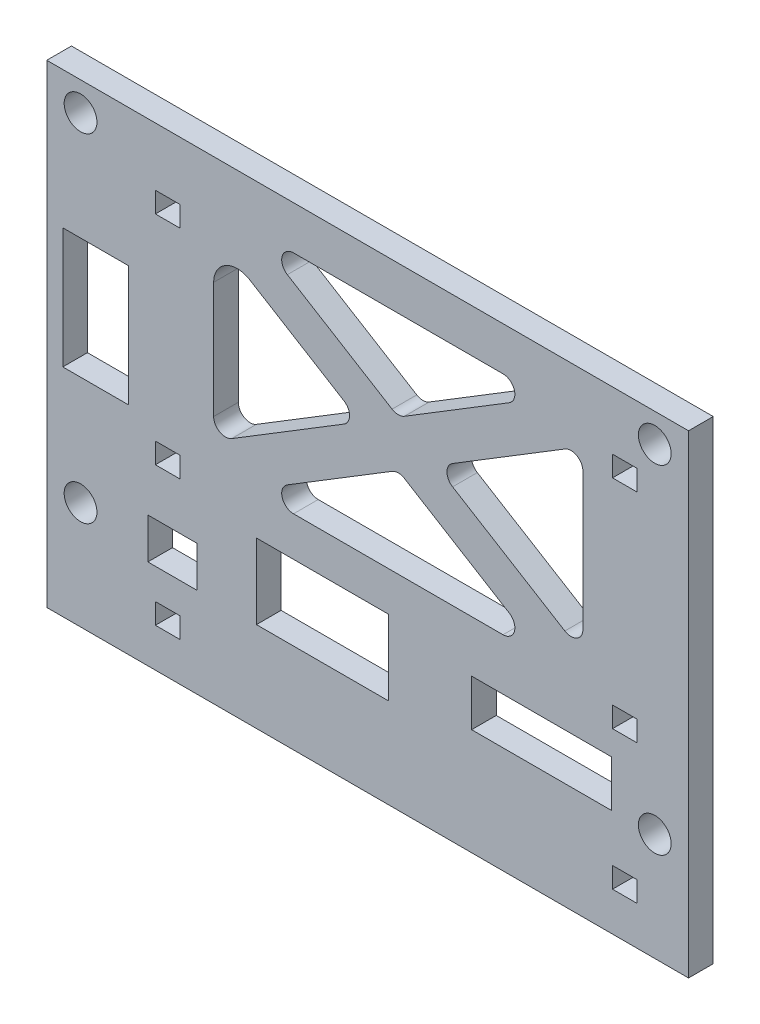
from build123d import *

# Parameters (mm, degrees)
SKETCH1_W              = 41.275
SKETCH1_H              = 25.4
SKETCH1_R              = 1.0541
SKETCH1_H_2            = 5.08
BOSS_EXTRUDE1_DEPTH    = 1.5875
ATTACHMENT_HOLES_REACH = 34.766
SKETCH3_W              = 1.5875
SKETCH3_H              = 1.3208
SKETCH2_W              = 8.509
SKETCH2_H              = 4.826
SKETCH2_W_2            = 4.22
SKETCH2_H_2            = 7.75
SKETCH2_W_3            = 3.175
SKETCH2_H_3            = 2.6162
SKETCH2_W_4            = 9
SKETCH2_H_4            = 2.985879982
CUT_EXTRUDE1_DEPTH     = 1.5875
FILLET8_R              = 0.762
FILLET9_R              = 1.524


with BuildPart() as part:
    # Sketch1 → Boss-Extrude1 (new body)
    # profile 1 of 2: a face of its own
    with BuildSketch(Plane.XY):
        with Locations((0, 12.7)):
            Rectangle(SKETCH1_W, SKETCH1_H)
        with Locations((-18.4658, 1.8415)):
            Circle(SKETCH1_R, mode=Mode.SUBTRACT)
        with Locations((18.4658, 1.8415)):
            Circle(SKETCH1_R, mode=Mode.SUBTRACT)
        with Locations((-18.4658, 23.5585)):
            Circle(SKETCH1_R, mode=Mode.SUBTRACT)
        with Locations((18.4658, 23.5585)):
            Circle(SKETCH1_R, mode=Mode.SUBTRACT)
    # profile 2 of 2: a face of its own
    with BuildSketch(Plane.XY):
        with Locations((0, -2.54)):
            Rectangle(SKETCH1_W, SKETCH1_H_2)
    extrude(amount=BOSS_EXTRUDE1_DEPTH)

    # Sketch3 → Attachment Holes (cut, up to next)
    with BuildSketch(Plane(origin=(0, 0, 0), x_dir=(-1, 0, 0), z_dir=(0, 0, -1)), mode=Mode.PRIVATE) as attachment_holes_sk1:
        with Locations((-16.54175, 20.992155968)):
            Rectangle(SKETCH3_W, SKETCH3_H)
    attachment_holes_tool1 = extrude(attachment_holes_sk1.sketch, amount=-ATTACHMENT_HOLES_REACH, mode=Mode.PRIVATE) & part.part
    # Sketch3 → Attachment Holes (cut, up to next)
    with BuildSketch(Plane(origin=(0, 0, 0), x_dir=(-1, 0, 0), z_dir=(0, 0, -1)), mode=Mode.PRIVATE) as attachment_holes_sk2:
        with Locations((-16.54175, 7.022155968)):
            Rectangle(SKETCH3_W, SKETCH3_H)
    attachment_holes_tool2 = extrude(attachment_holes_sk2.sketch, amount=-ATTACHMENT_HOLES_REACH, mode=Mode.PRIVATE) & part.part
    # Sketch3 → Attachment Holes (cut, up to next)
    with BuildSketch(Plane(origin=(0, 0, 0), x_dir=(-1, 0, 0), z_dir=(0, 0, -1)), mode=Mode.PRIVATE) as attachment_holes_sk3:
        with Locations((-16.54175, -1.918644032)):
            Rectangle(SKETCH3_W, SKETCH3_H)
    attachment_holes_tool3 = extrude(attachment_holes_sk3.sketch, amount=-ATTACHMENT_HOLES_REACH, mode=Mode.PRIVATE) & part.part
    # Sketch3 → Attachment Holes (cut, up to next)
    with BuildSketch(Plane(origin=(0, 0, 0), x_dir=(-1, 0, 0), z_dir=(0, 0, -1)), mode=Mode.PRIVATE) as attachment_holes_sk4:
        with Locations((12.85875, 20.992155968)):
            Rectangle(SKETCH3_W, SKETCH3_H)
    attachment_holes_tool4 = extrude(attachment_holes_sk4.sketch, amount=-ATTACHMENT_HOLES_REACH, mode=Mode.PRIVATE) & part.part
    # Sketch3 → Attachment Holes (cut, up to next)
    with BuildSketch(Plane(origin=(0, 0, 0), x_dir=(-1, 0, 0), z_dir=(0, 0, -1)), mode=Mode.PRIVATE) as attachment_holes_sk5:
        with Locations((12.85875, 7.022155968)):
            Rectangle(SKETCH3_W, SKETCH3_H)
    attachment_holes_tool5 = extrude(attachment_holes_sk5.sketch, amount=-ATTACHMENT_HOLES_REACH, mode=Mode.PRIVATE) & part.part
    # Sketch3 → Attachment Holes (cut, up to next)
    with BuildSketch(Plane(origin=(0, 0, 0), x_dir=(-1, 0, 0), z_dir=(0, 0, -1)), mode=Mode.PRIVATE) as attachment_holes_sk6:
        with Locations((12.85875, -1.918644032)):
            Rectangle(SKETCH3_W, SKETCH3_H)
    attachment_holes_tool6 = extrude(attachment_holes_sk6.sketch, amount=-ATTACHMENT_HOLES_REACH, mode=Mode.PRIVATE) & part.part
    add(attachment_holes_tool1.solids().sort_by_distance((16.54175, 20.992156, 0))[0], mode=Mode.SUBTRACT)
    add(attachment_holes_tool2.solids().sort_by_distance((16.54175, 7.022156, 0))[0], mode=Mode.SUBTRACT)
    add(attachment_holes_tool3.solids().sort_by_distance((16.54175, -1.918644, 0))[0], mode=Mode.SUBTRACT)
    add(attachment_holes_tool4.solids().sort_by_distance((-12.85875, 20.992156, 0))[0], mode=Mode.SUBTRACT)
    add(attachment_holes_tool5.solids().sort_by_distance((-12.85875, 7.022156, 0))[0], mode=Mode.SUBTRACT)
    add(attachment_holes_tool6.solids().sort_by_distance((-12.85875, -1.918644, 0))[0], mode=Mode.SUBTRACT)

    # Sketch2 → Cut-Extrude1 (cut)
    with BuildSketch(Plane.XY.offset(1.5875)):
        Polygon((11.409828794, 8.0735), (1.9685, 13.850842654), (-7.472828794, 8.0735), align=None)
        Polygon((13.843, 21.117092654), (4.401671206, 15.33975), (13.843, 9.562407346), align=None)
        Polygon((-7.472828794, 22.606), (1.9685, 16.828657346), (11.409828794, 22.606), align=None)
        Polygon((-0.464671206, 15.33975), (-9.906, 21.117092654), (-9.906, 9.562407346), align=None)
        with Locations((-2.8993, 3.1205)):
            Rectangle(SKETCH2_W, SKETCH2_H)
        with Locations((-17.4978, 12.709)):
            Rectangle(SKETCH2_W_2, SKETCH2_H_2)
        with Locations((-12.5513, 2.0156)):
            Rectangle(SKETCH2_W_3, SKETCH2_H_3)
        with Locations((11.1858, 3.267239991)):
            Rectangle(SKETCH2_W_4, SKETCH2_H_4)
    extrude(amount=-CUT_EXTRUDE1_DEPTH, mode=Mode.SUBTRACT)

    # Fillet8
    fillet8_edges = [part.edges().sort_by_distance(p)[0] for p in [
        (-7.472828794, 8.0735, 0.79375),
        (1.9685, 13.850842654, 0.79375),
        (11.409828794, 8.0735, 0.79375),
        (4.401671206, 15.33975, 0.79375),
        (13.843, 21.117092654, 0.79375),
        (13.843, 9.562407346, 0.79375),
        (1.9685, 16.828657346, 0.79375),
        (-7.472828794, 22.606, 0.79375),
        (11.409828794, 22.606, 0.79375),
        (-9.906, 9.562407346, 0.79375),
        (-0.464671206, 15.33975, 0.79375),
    ]]
    fillet(fillet8_edges, radius=FILLET8_R)

    # Fillet9
    fillet9_edges = [part.edges().sort_by_distance(p)[0] for p in [
        (-9.906, 21.117092654, 0.79375),
    ]]
    fillet(fillet9_edges, radius=FILLET9_R)


solid = part.part
